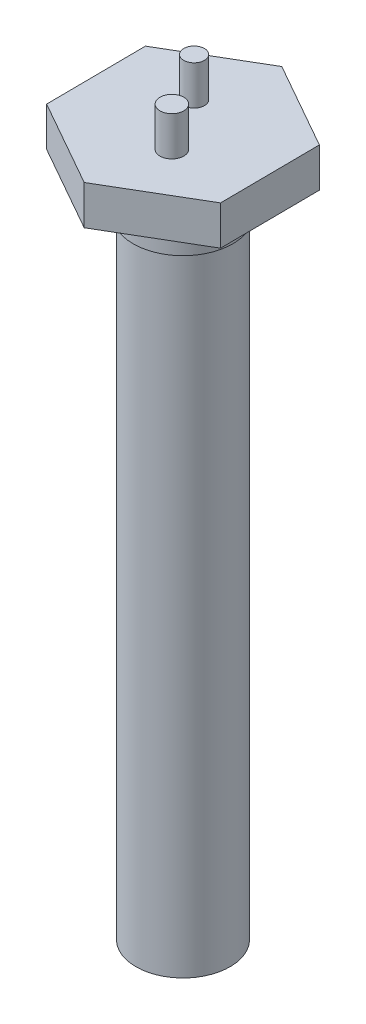
from build123d import *

# Parameters (mm, degrees)
BOSS_EXTRUDE4_DEPTH = 180
SKETCH1_12_R        = 12.7
SKETCH1_12_R_2      = 12
SKETCH1_12_R_3      = 2.630172239
SKETCH1_12_R_4      = 3.026737684
BOSS_EXTRUDE7_DEPTH = 170
SKETCH1_15_R        = 12.7
SKETCH1_15_R_2      = 12
SKETCH1_15_R_3      = 2.630172239
SKETCH1_15_R_4      = 3.026737684
CUT_EXTRUDE1_DEPTH  = 170
SKETCH1_17_R        = 12
SKETCH1_17_R_2      = 2.630172239
SKETCH1_17_R_3      = 3.026737684
BOSS_EXTRUDE8_DEPTH = 170
SKETCH1_19_R        = 12.7
SKETCH1_19_R_2      = 12
CUT_EXTRUDE4_DEPTH  = 160
SKETCH1_20_R        = 2.630172239
SKETCH1_20_R_2      = 3.026737684
BOSS_EXTRUDE9_DEPTH = 190


with BuildPart() as part:
    # Sketch1 → Boss-Extrude4 (new body)
    with BuildSketch(Plane(origin=(0, 0, 0), x_dir=(1, 0, 0), z_dir=(0, 1, 0))):
        Polygon((13.512564063, 26.522822061), (13.303604139, 51.921962514), (-8.797176689, 64.440568137), (-30.688997594, 51.560033308), (-30.48003767, 26.160892855), (-8.379256841, 13.642287231), align=None)
    extrude(amount=BOSS_EXTRUDE4_DEPTH)

    # Sketch1<12> → Boss-Extrude7 (add)
    # profile 1 of 2: a face of its own
    with BuildSketch(Plane(origin=(0, 0, 0), x_dir=(1, 0, 0), z_dir=(0, 1, 0))):
        Polygon((13.512564063, 26.522822061), (13.303604139, 51.921962514), (-8.797176689, 64.440568137), (-30.688997594, 51.560033308), (-30.48003767, 26.160892855), (-8.379256841, 13.642287231), align=None)
        with Locations((-8.588216765, 39.041427684)):
            Circle(SKETCH1_12_R, mode=Mode.SUBTRACT)
    # profile 2 of 2: a face of its own
    with BuildSketch(Plane(origin=(0, 0, 0), x_dir=(1, 0, 0), z_dir=(0, 1, 0))):
        with Locations((-8.588216765, 39.041427684)):
            Circle(SKETCH1_12_R_2)
        with Locations((-12.645078129, 45.936489387)):
            Circle(SKETCH1_12_R_3, mode=Mode.SUBTRACT)
        with Locations((-4.531355402, 32.146365982)):
            Circle(SKETCH1_12_R_4, mode=Mode.SUBTRACT)
    extrude(amount=BOSS_EXTRUDE7_DEPTH)

    # Sketch1<15> → Cut-Extrude1 (cut)
    # profile 1 of 2: a face of its own
    with BuildSketch(Plane(origin=(0, 0, 0), x_dir=(1, 0, 0), z_dir=(0, 1, 0))):
        Polygon((13.512564063, 26.522822061), (13.303604139, 51.921962514), (-8.797176689, 64.440568137), (-30.688997594, 51.560033308), (-30.48003767, 26.160892855), (-8.379256841, 13.642287231), align=None)
        with Locations(Location((-8.588216765, 39.041427684, 0), (0, 0, 270))):
            Circle(SKETCH1_15_R, mode=Mode.SUBTRACT)
    # profile 2 of 2: a face of its own
    with BuildSketch(Plane(origin=(0, 0, 0), x_dir=(1, 0, 0), z_dir=(0, 1, 0))):
        with Locations(Location((-8.588216765, 39.041427684, 0), (0, 0, 270))):
            Circle(SKETCH1_15_R_2)
        with Locations(Location((-12.645078129, 45.936489387, 0), (0, 0, 270))):
            Circle(SKETCH1_15_R_3, mode=Mode.SUBTRACT)
        with Locations(Location((-4.531355402, 32.146365982, 0), (0, 0, 270))):
            Circle(SKETCH1_15_R_4, mode=Mode.SUBTRACT)
    extrude(amount=CUT_EXTRUDE1_DEPTH, mode=Mode.SUBTRACT)

    # Sketch1<17> → Boss-Extrude8 (add)
    with BuildSketch(Plane(origin=(0, 0, 0), x_dir=(1, 0, 0), z_dir=(0, 1, 0))):
        with Locations((-8.588216765, 39.041427684)):
            Circle(SKETCH1_17_R)
        with Locations((-12.645078129, 45.936489387)):
            Circle(SKETCH1_17_R_2, mode=Mode.SUBTRACT)
        with Locations((-4.531355402, 32.146365982)):
            Circle(SKETCH1_17_R_3, mode=Mode.SUBTRACT)
    extrude(amount=BOSS_EXTRUDE8_DEPTH)

    # Sketch1<19> → Cut-Extrude4 (cut)
    with BuildSketch(Plane(origin=(0, 0, 0), x_dir=(1, 0, 0), z_dir=(0, 1, 0))):
        with Locations(Location((-8.588216765, 39.041427684, 0), (0, 0, 270))):
            Circle(SKETCH1_19_R)
        with Locations(Location((-8.588216765, 39.041427684, 0), (0, 0, 270))):
            Circle(SKETCH1_19_R_2, mode=Mode.SUBTRACT)
    extrude(amount=CUT_EXTRUDE4_DEPTH, mode=Mode.SUBTRACT)

    # Sketch1<20> → Boss-Extrude9 (add)
    with BuildSketch(Plane(origin=(0, 0, 0), x_dir=(1, 0, 0), z_dir=(0, 1, 0))):
        with Locations(Location((-12.645078129, 45.936489387, 0), (0, 0, 270))):
            Circle(SKETCH1_20_R)
        with Locations(Location((-4.531355402, 32.146365982, 0), (0, 0, 270))):
            Circle(SKETCH1_20_R_2)
    extrude(amount=BOSS_EXTRUDE9_DEPTH)


solid = part.part
